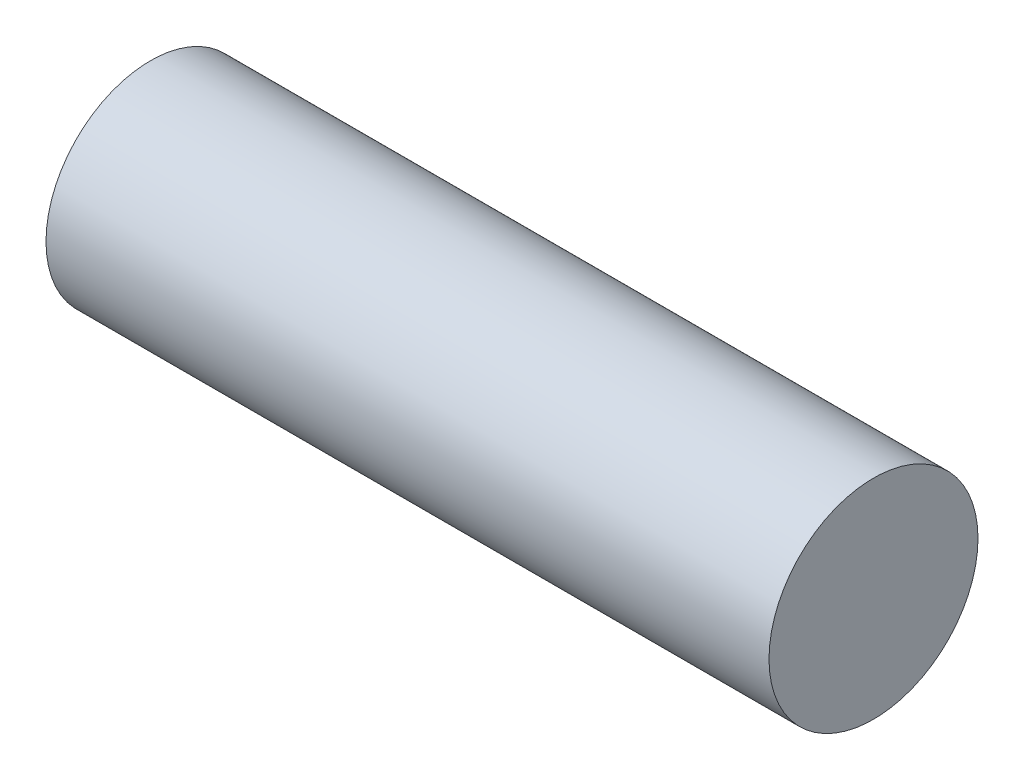
from build123d import *

# Parameters (mm, degrees)
SKETCH2_W = 11.9
SKETCH2_H = 1.72


with BuildPart() as part:
    # Sketch2 → Revolve1 (revolve)
    with BuildSketch(Plane.XY, mode=Mode.PRIVATE) as revolve1_sk:
        with Locations((-3.205905512, 0.86)):
            Rectangle(SKETCH2_W, SKETCH2_H)
    revolve(revolve1_sk.sketch.rotate(Axis((-9.155905512, 0, 0), (1, 0, 0)), 90), axis=Axis((-9.155905512, 0, 0), (1, 0, 0)))


solid = part.part
